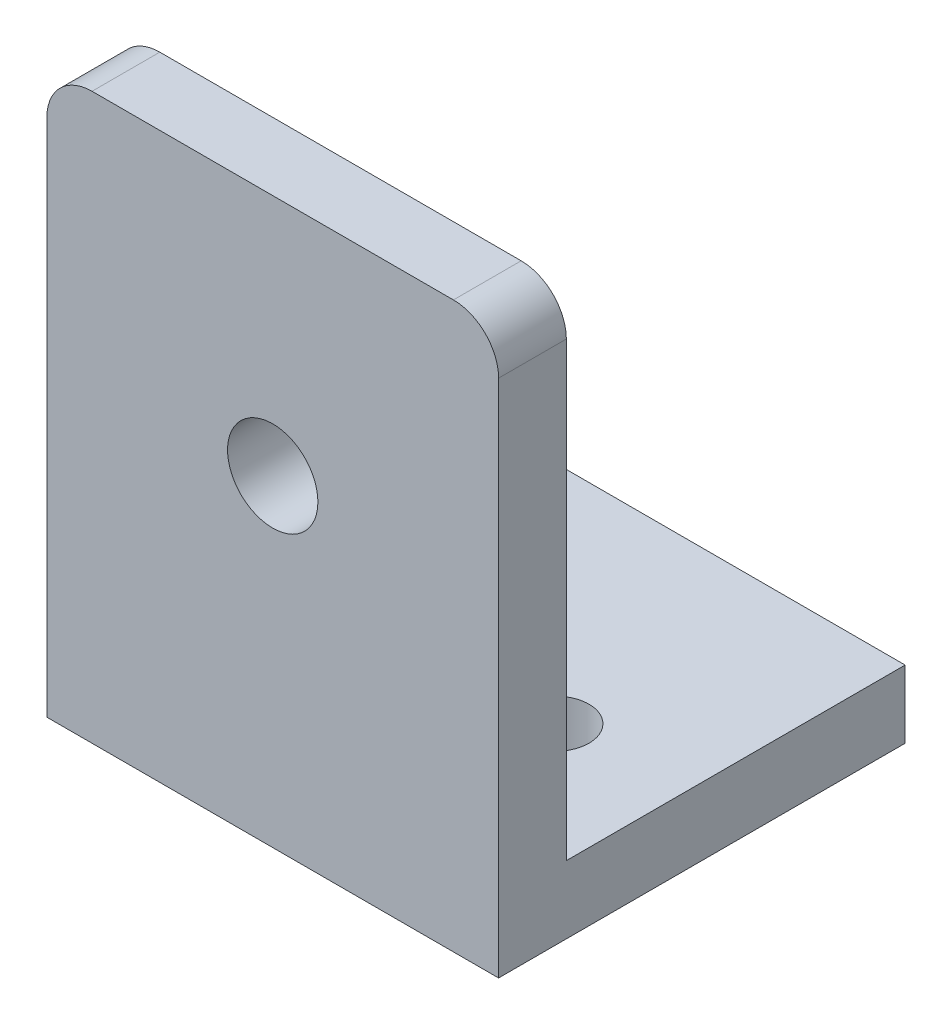
from build123d import *

# Parameters (mm, degrees)
EXTRUDE_1_DEPTH     = 20
SKETCH_2_R          = 1.5
CUT_EXTRUDE_1_DEPTH = 35.756294394
FILLET_1_R          = 2
SKETCH_3_R          = 2
CUT_EXTRUDE_2_DEPTH = 37.728735344


with BuildPart() as part:
    # 草图1 → 凸台-拉伸1 (new body)
    with BuildSketch(Plane(origin=(0, 0, 0), x_dir=(0, 0, -1), z_dir=(1, 0, 0))):
        Polygon((0, 0), (0, 25), (3, 25), (3, 3), (18, 3), (18, 0), align=None)
    extrude(amount=EXTRUDE_1_DEPTH)

    # 草图2 → 切除-拉伸1 (cut, through all)
    with BuildSketch(Plane(origin=(0, 3, 0), x_dir=(1, 0, 0), z_dir=(0, 1, 0))):
        with Locations(Location((5.5, 8, 0), (0, 0, 270))):
            Circle(SKETCH_2_R)
        with Locations(Location((14.5, 8, 0), (0, 0, 270))):
            Circle(SKETCH_2_R)
    extrude(amount=-CUT_EXTRUDE_1_DEPTH, mode=Mode.SUBTRACT)

    # 圆角1
    fillet_1_edges = [part.edges().sort_by_distance(p)[0] for p in [
        (20, 25, -1.5),
        (0, 25, -1.5),
    ]]
    fillet(fillet_1_edges, radius=FILLET_1_R)

    # 草图3 → 切除-拉伸2 (cut, through all)
    with BuildSketch(Plane.XY):
        with Locations((10, 14.25)):
            Circle(SKETCH_3_R)
    extrude(amount=-CUT_EXTRUDE_2_DEPTH, mode=Mode.SUBTRACT)


solid = part.part
